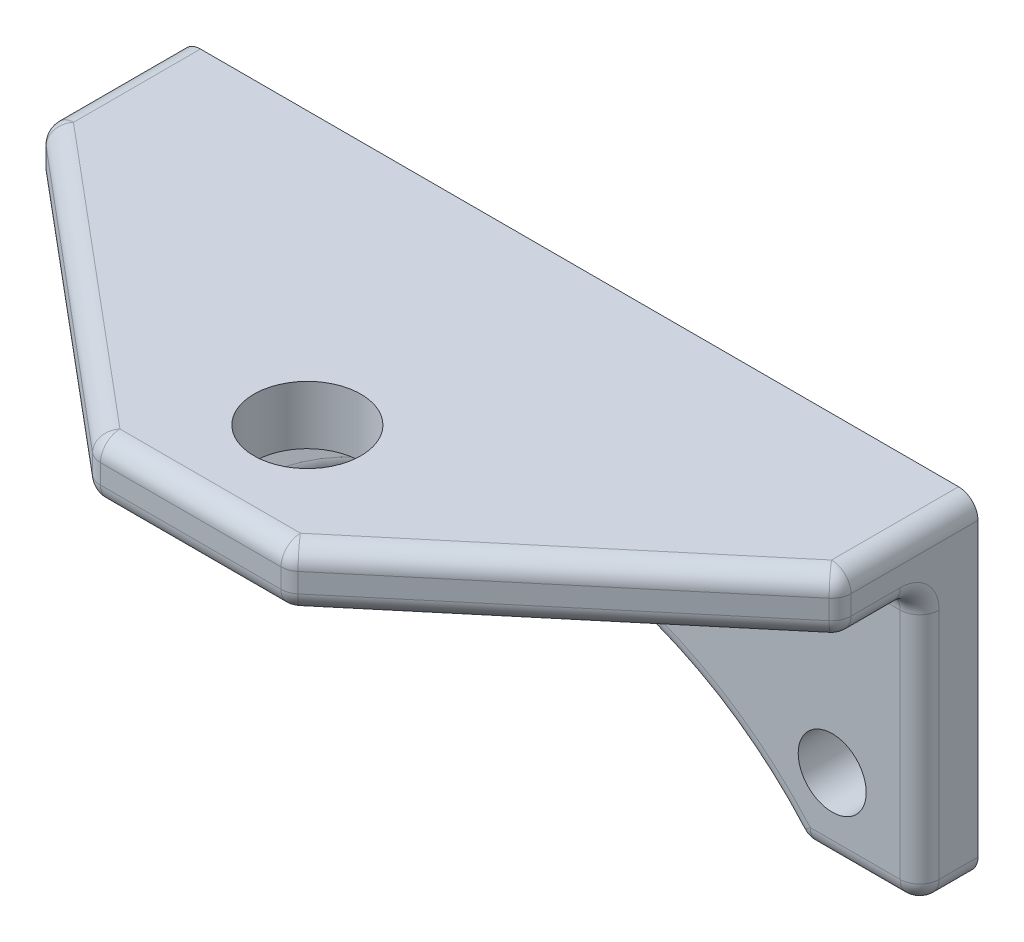
from build123d import *

# Parameters (mm, degrees)
SKETCH1_R           = 1.75
BOSS_EXTRUDE1_DEPTH = 3
SKETCH2_R           = 2.75
BOSS_EXTRUDE2_DEPTH = 3
FILLET1_R           = 1


with BuildPart() as part:
    # Sketch1 → Boss-Extrude1 (new body)
    with BuildSketch(Plane.XY):
        with BuildLine():
            Line((-20.5, 7), (-20.5, -7))
            Line((-20.5, -7), (-14.407029534, -7))
            ThreePointArc((-14.407029534, -7), (0, -0.25), (14.407029534, -7))
            Line((14.407029534, -7), (20.5, -7))
            Line((20.5, -7), (20.5, 7))
            Line((20.5, 7), (-20.5, 7))
        make_face()
        with Locations((-16, -3)):
            Circle(SKETCH1_R, mode=Mode.SUBTRACT)
        with Locations(Location((16, -3, 0), (0, 0, 180))):
            Circle(SKETCH1_R, mode=Mode.SUBTRACT)
    extrude(amount=BOSS_EXTRUDE1_DEPTH)

    # Sketch2 → Boss-Extrude2 (add)
    with BuildSketch(Plane(origin=(0, 7, 0), x_dir=(1, 0, 0), z_dir=(0, 1, 0))):
        Polygon((-20.5, 0), (20.5, 0), (20.5, -7), (5.007203296, -20), (-5.007203296, -20), (-20.5, -7), align=None)
        with Locations(Location((0, -14, 0), (0, 0, 270))):
            Circle(SKETCH2_R, mode=Mode.SUBTRACT)
    extrude(amount=BOSS_EXTRUDE2_DEPTH)

    # Fillet1
    fillet1_edges = [part.edges().sort_by_distance(p)[0] for p in [
        (20.5, 0, 3),
        (-14.407029534, -7, 1.5),
        (-20.5, -7, 1.5),
        (20.5, -7, 1.5),
        (14.407029534, -7, 1.5),
        (0, 7, 3),
        (-20.5, 0, 3),
        (-17.453514767, -7, 3),
        (-12.753601648, 10, 13.5),
        (0, 10, 20),
        (12.753601648, 10, 13.5),
        (20.5, 10, 3.5),
        (-20.5, 10, 3.5),
        (-12.753601648, 7, 13.5),
        (-20.5, 8.5, 7),
        (0, 7, 20),
        (-5.007203296, 8.5, 20),
        (12.753601648, 7, 13.5),
        (5.007203296, 8.5, 20),
        (20.5, 7, 5),
        (20.5, 8.5, 7),
        (-20.5, 7, 5),
        (0, -0.25, 3),
        (17.453514767, -7, 3),
    ]]
    fillet(fillet1_edges, radius=FILLET1_R)


solid = part.part
